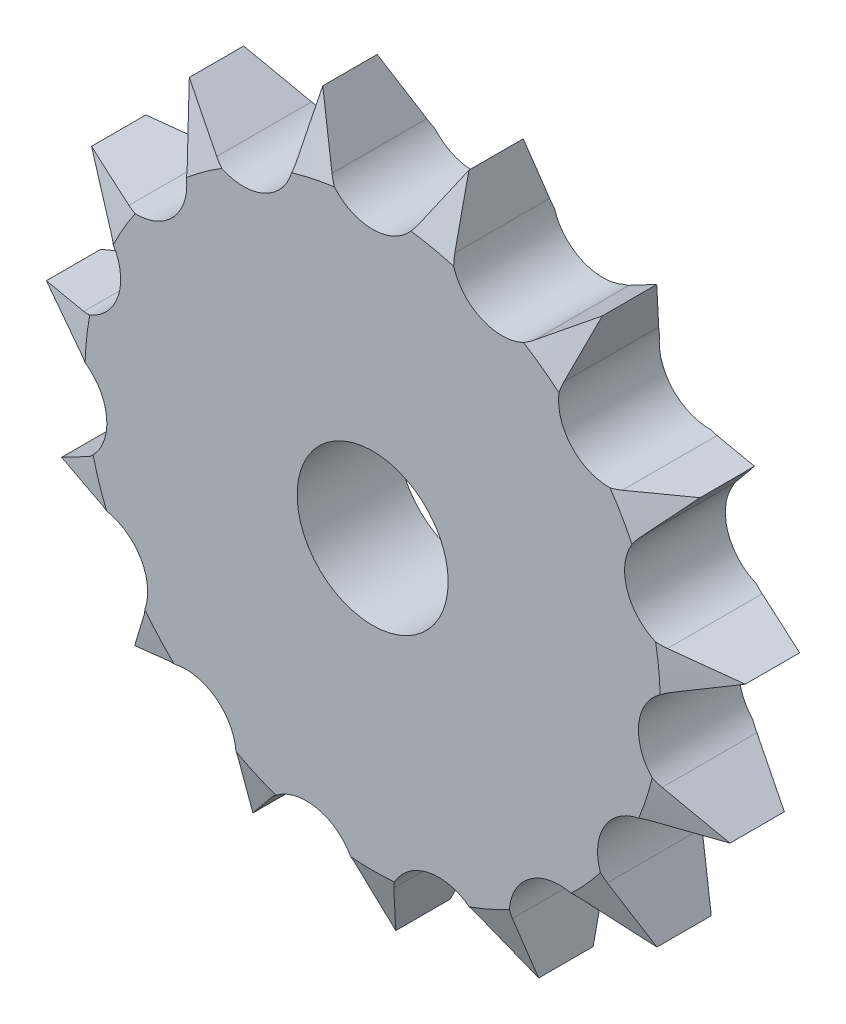
from build123d import *

# Parameters (mm, degrees)
IZIM1_R                     = 35
Y_KSEKLIK_EKSTR_ZYON1_DEPTH = 10
KES_EKSTR_ZYON1_DEPTH       = 10
DAIRESEL_KAPLAMA1_COUNT     = 15
IZIM8_R                     = 7.5
KES_EKSTR_ZYON2_DEPTH       = 10


with BuildPart() as part:
    # Çizim1 → Yükseklik-Ekstrüzyon1 (new body)
    with BuildSketch(Plane.XY):
        Circle(IZIM1_R)
    extrude(amount=-Y_KSEKLIK_EKSTR_ZYON1_DEPTH)

    # Çizim2 → Kes-Ekstrüzyon1 (cut)
    with BuildSketch(Plane.XY):
        with BuildLine():
            Line((-4.330127019, 29.061737365), (-9.008699853, 37.16526322))
            Line((-9.008699853, 37.16526322), (9.008699853, 37.16526322))
            Line((9.008699853, 37.16526322), (4.330127019, 29.061737365))
            ThreePointArc((4.330127019, 29.061737365), (0, 26.561737365), (-4.330127019, 29.061737365))
        make_face()
    kes_ekstr_zyon1 = extrude(amount=-KES_EKSTR_ZYON1_DEPTH, mode=Mode.SUBTRACT)

    # Dairesel Kaplama1: Kes-Ekstrüzyon1 ×15 about axis
    dairesel_kaplama1_axis = Axis((0, 0, 0), (0, 0, 1))
    for i in range(1, DAIRESEL_KAPLAMA1_COUNT):
        add(kes_ekstr_zyon1.rotate(dairesel_kaplama1_axis, i * 360 / DAIRESEL_KAPLAMA1_COUNT), mode=Mode.SUBTRACT)

    # Çizim8 → Kes-Ekstrüzyon2 (cut)
    with BuildSketch(Plane.XY):
        Circle(IZIM8_R)
    extrude(amount=-KES_EKSTR_ZYON2_DEPTH, mode=Mode.SUBTRACT)

    # Çizim11 → Kes-Döndür1 (revolve, cut)
    with BuildSketch(Plane(origin=(0, 0, 0), x_dir=(0, 0, -1), z_dir=(1, 0, 0))):
        Polygon((0, 28.561737365), (2.911761874, 36.561737365), (0, 36.561737365), align=None)
        Polygon((10, 36.561737365), (7.088238126, 36.561737365), (10, 28.561737365), align=None)
    revolve(axis=Axis((0, 0, 2.836239844), (0, 0, -1)), mode=Mode.SUBTRACT)


solid = part.part
